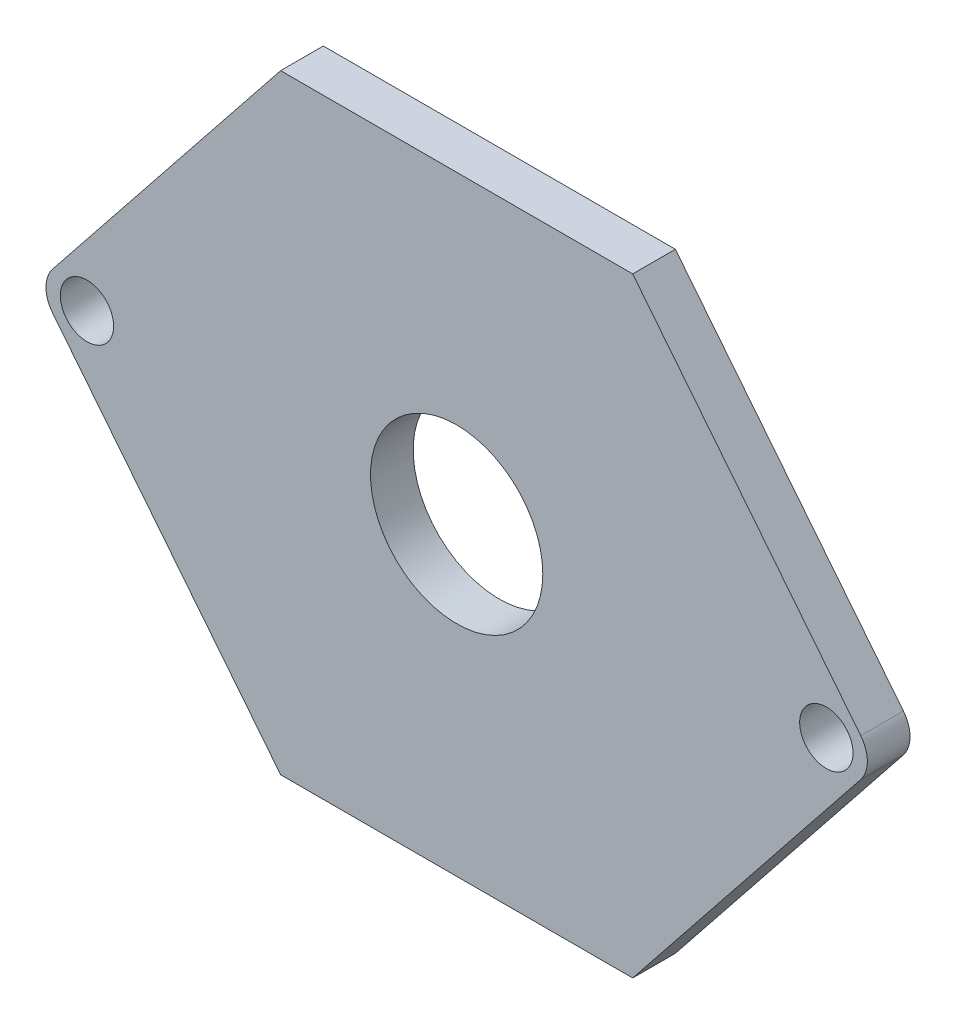
from build123d import *

# Parameters (mm, degrees)
SKETCH1_R           = 5.650668072
SKETCH1_R_2         = 1.75
BOSS_EXTRUDE1_DEPTH = 2.8
FILLET1_R           = 2


with BuildPart() as part:
    # Sketch1 → Boss-Extrude1 (new body)
    with BuildSketch(Plane.XY):
        Polygon((11.547005384, 20), (27.5, 0), (11.547005384, -20), (-11.547005384, -20), (-27.5, 0), (-11.547005384, 20), align=None)
        Circle(SKETCH1_R, mode=Mode.SUBTRACT)
        with Locations((-24.25, 0)):
            Circle(SKETCH1_R_2, mode=Mode.SUBTRACT)
        with Locations((24.25, 0)):
            Circle(SKETCH1_R_2, mode=Mode.SUBTRACT)
    extrude(amount=BOSS_EXTRUDE1_DEPTH)

    # Fillet1
    fillet1_edges = [part.edges().sort_by_distance(p)[0] for p in [
        (27.5, 0, 1.4),
        (-27.5, 0, 1.4),
    ]]
    fillet(fillet1_edges, radius=FILLET1_R)


solid = part.part
